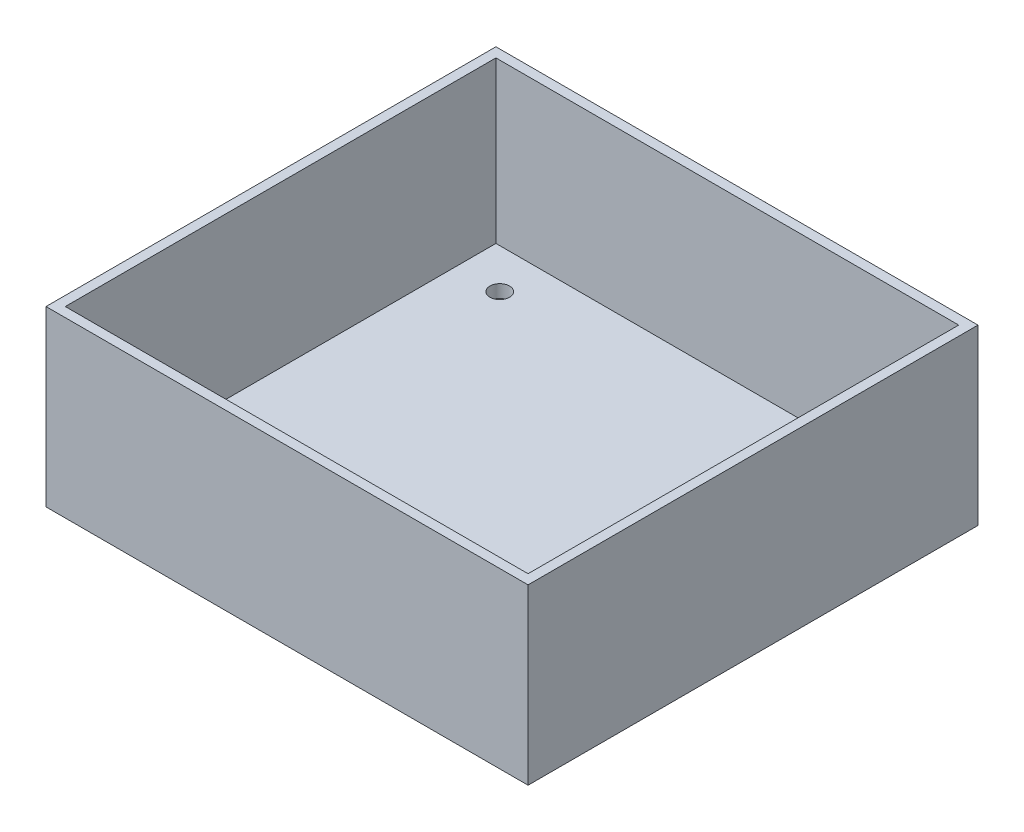
from build123d import *

# Parameters (mm, degrees)
CROQUIS1_W              = 75
CROQUIS1_H              = 70
SALIENTE_EXTRUIR1_DEPTH = 2
CROQUIS2_W              = 75
CROQUIS2_H              = 70
CROQUIS2_W_2            = 72
CROQUIS2_H_2            = 67
SALIENTE_EXTRUIR2_DEPTH = 25
CROQUIS3_R              = 1.525
CORTAR_EXTRUIR1_DEPTH   = 10


with BuildPart() as part:
    # Croquis1 → Saliente-Extruir1 (new body)
    with BuildSketch(Plane(origin=(0, 0, 0), x_dir=(1, 0, 0), z_dir=(0, 1, 0))):
        Rectangle(CROQUIS1_W, CROQUIS1_H)
    extrude(amount=SALIENTE_EXTRUIR1_DEPTH)

    # Croquis2 → Saliente-Extruir2 (add)
    with BuildSketch(Plane(origin=(0, 2, 0), x_dir=(1, 0, 0), z_dir=(0, 1, 0))):
        Rectangle(CROQUIS2_W, CROQUIS2_H)
        Rectangle(CROQUIS2_W_2, CROQUIS2_H_2, mode=Mode.SUBTRACT)
    extrude(amount=SALIENTE_EXTRUIR2_DEPTH)

    # Croquis3 → Cortar-Extruir1 (cut)
    with BuildSketch(Plane(origin=(0, 2, 0), x_dir=(1, 0, 0), z_dir=(0, 1, 0))):
        with Locations(Location((-29.21, 27.305, 0), (0, 0, 270))):
            Circle(CROQUIS3_R)
        with Locations(Location((-29.21, -27.305, 0), (0, 0, 270))):
            Circle(CROQUIS3_R)
        with Locations(Location((29.21, 27.305, 0), (0, 0, 270))):
            Circle(CROQUIS3_R)
        with Locations(Location((29.21, -27.3049805, 0), (0, 0, 270))):
            Circle(CROQUIS3_R)
    extrude(amount=-CORTAR_EXTRUIR1_DEPTH, mode=Mode.SUBTRACT)


solid = part.part
